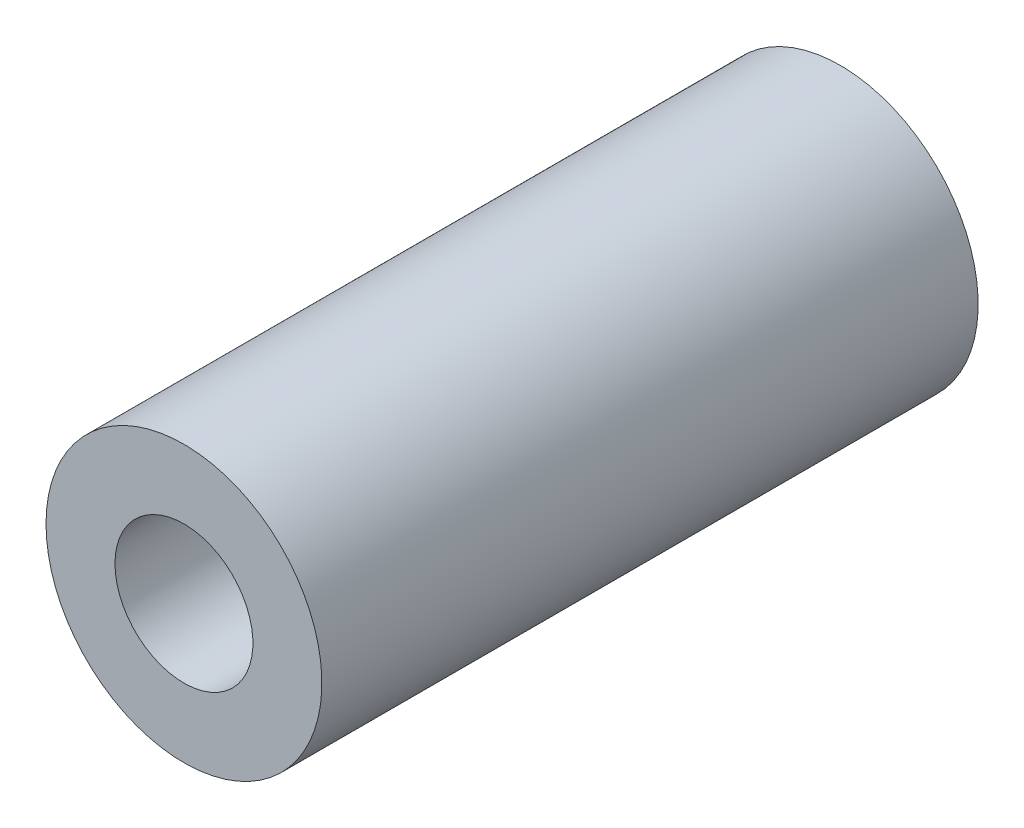
from build123d import *

# Parameters (mm, degrees)
SKETCH1_R           = 6.35
SKETCH1_R_2         = 3.175
BOSS_EXTRUDE1_DEPTH = 15.10665


with BuildPart() as part:
    # Sketch1 → Boss-Extrude1 (new, symmetric)
    with BuildSketch(Plane.XY):
        with Locations(Location((0, 0, 0), (0, 0, 180))):
            Circle(SKETCH1_R)
        with Locations(Location((0, 0, 0), (0, 0, 180))):
            Circle(SKETCH1_R_2, mode=Mode.SUBTRACT)
    extrude(amount=BOSS_EXTRUDE1_DEPTH, both=True)


solid = part.part
